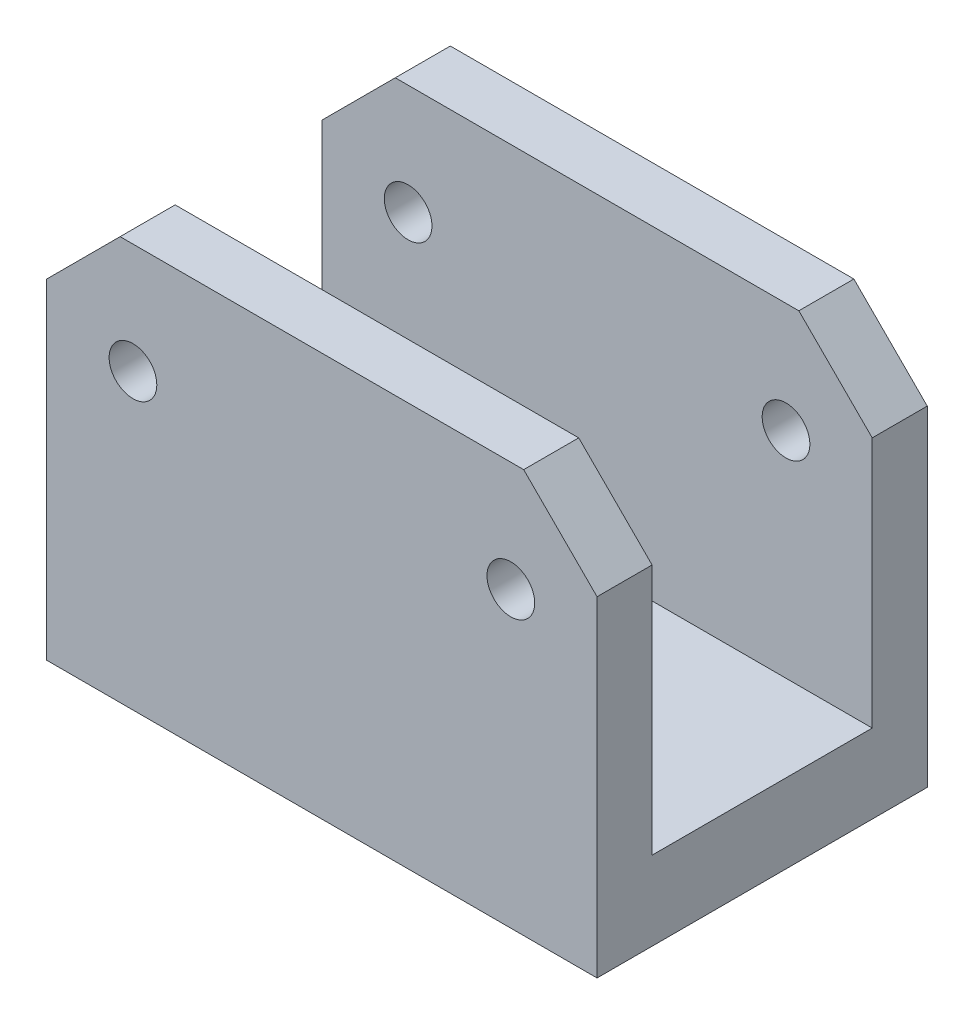
from build123d import *

# Parameters (mm, degrees)
SKETCH_2_R          = 1.3
EXTRUDE_1_DEPTH     = 9
SKETCH_3_W          = 30
SKETCH_3_H          = 20.835575778
CUT_EXTRUDE_1_DEPTH = 6
CUT_EXTRUDE_2_REACH = 22.664
SKETCH_4_R          = 1.25


with BuildPart() as part:
    # 草图2 → 凸台-拉伸1 (new, symmetric)
    with BuildSketch(Plane.XY):
        Polygon((-11, 11), (11, 11), (15, 7), (15, -11), (-15, -11), (-15, 7), align=None)
        with Locations((-10.3, 5)):
            Circle(SKETCH_2_R, mode=Mode.SUBTRACT)
        with Locations(Location((10.3, 5, 0), (0, 0, 180))):
            Circle(SKETCH_2_R, mode=Mode.SUBTRACT)
    extrude(amount=EXTRUDE_1_DEPTH, both=True)

    # 草图3 → 切除-拉伸1 (cut, symmetric)
    with BuildSketch(Plane.XY):
        with Locations((0, 3.717787889)):
            Rectangle(SKETCH_3_W, SKETCH_3_H)
    extrude(amount=CUT_EXTRUDE_1_DEPTH, both=True, mode=Mode.SUBTRACT)

    # 草图4 → 切除-拉伸2 (cut, up to next)
    with BuildSketch(Plane(origin=(0, 0, 0), x_dir=(1, 0, 0), z_dir=(0, 1, 0)), mode=Mode.PRIVATE) as cut_extrude_2_sk1:
        with Locations(Location((0, 0, 0), (0, 0, 270))):
            Circle(SKETCH_4_R)
    cut_extrude_2_tool1 = extrude(cut_extrude_2_sk1.sketch, amount=-CUT_EXTRUDE_2_REACH, mode=Mode.PRIVATE) & part.part
    add(cut_extrude_2_tool1.solids().sort_by_distance((0, 0, 0))[0], mode=Mode.SUBTRACT)


solid = part.part
